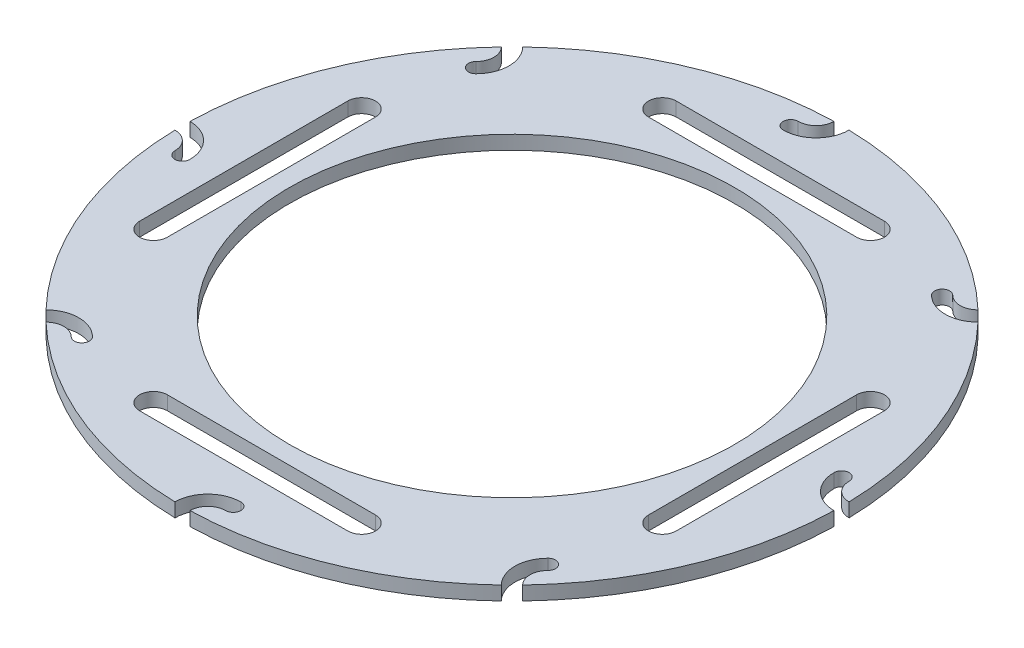
from build123d import *

# Parameters (mm, degrees)
SKETCH1_R           = 9.625
BOSS_EXTRUDE1_DEPTH = 0.6


with BuildPart() as part:
    # Sketch1 → Boss-Extrude1 (new body)
    with BuildSketch(Plane(origin=(0, 0, 0), x_dir=(1, 0, 0), z_dir=(0, 1, 0))):
        with BuildLine():
            ThreePointArc((13.474991136, 1.1), (13.700677051, 0.553298036), (14.246293378, 0.325))
            ThreePointArc((14.246293378, 0.325), (13.165283338, 5.453238911), (10.303460358, 9.84384095))
            ThreePointArc((10.303460358, 9.84384095), (9.29660086, 9.429085476), (8.290823601, 9.846458519))
            ThreePointArc((8.290823601, 9.846458519), (8.290823601, 10.306075068), (8.750440149, 10.306075068))
            ThreePointArc((8.750440149, 10.306075068), (9.296600856, 10.079082443), (9.84384095, 10.303460358))
            ThreePointArc((9.84384095, 10.303460358), (5.453238911, 13.165283338), (0.325, 14.246293378))
            ThreePointArc((0.325, 14.246293378), (-0.09368077, 13.24105979), (-1.1, 12.824995179))
            ThreePointArc((-1.1, 12.824995179), (-1.424997978, 13.149993158), (-1.1, 13.474991136))
            ThreePointArc((-1.1, 13.474991136), (-0.553298036, 13.700677051), (-0.325, 14.246293378))
            ThreePointArc((-0.325, 14.246293378), (-5.453238911, 13.165283338), (-9.84384095, 10.303460358))
            ThreePointArc((-9.84384095, 10.303460358), (-9.429085476, 9.29660086), (-9.846458519, 8.290823601))
            ThreePointArc((-9.846458519, 8.290823601), (-10.306075068, 8.290823601), (-10.306075068, 8.750440149))
            ThreePointArc((-10.306075068, 8.750440149), (-10.079082443, 9.296600856), (-10.303460358, 9.84384095))
            ThreePointArc((-10.303460358, 9.84384095), (-13.165283338, 5.453238911), (-14.246293378, 0.325))
            ThreePointArc((-14.246293378, 0.325), (-13.24105979, -0.09368077), (-12.824995179, -1.1))
            ThreePointArc((-12.824995179, -1.1), (-13.149993158, -1.424997978), (-13.474991136, -1.1))
            ThreePointArc((-13.474991136, -1.1), (-13.700677051, -0.553298036), (-14.246293378, -0.325))
            ThreePointArc((-14.246293378, -0.325), (-13.165283338, -5.453238911), (-10.303460358, -9.84384095))
            ThreePointArc((-10.303460358, -9.84384095), (-9.29660086, -9.429085476), (-8.290823601, -9.846458519))
            ThreePointArc((-8.290823601, -9.846458519), (-8.290823601, -10.306075068), (-8.750440149, -10.306075068))
            ThreePointArc((-8.750440149, -10.306075068), (-9.296600856, -10.079082443), (-9.84384095, -10.303460358))
            ThreePointArc((-9.84384095, -10.303460358), (-5.453238911, -13.165283338), (-0.325, -14.246293378))
            ThreePointArc((-0.325, -14.246293378), (0.09368077, -13.24105979), (1.1, -12.824995179))
            ThreePointArc((1.1, -12.824995179), (1.424997978, -13.149993158), (1.1, -13.474991136))
            ThreePointArc((1.1, -13.474991136), (0.553298036, -13.700677051), (0.325, -14.246293378))
            ThreePointArc((0.325, -14.246293378), (5.453238911, -13.165283338), (9.84384095, -10.303460358))
            ThreePointArc((9.84384095, -10.303460358), (9.429085476, -9.29660086), (9.846458519, -8.290823601))
            ThreePointArc((9.846458519, -8.290823601), (10.306075068, -8.290823601), (10.306075068, -8.750440149))
            ThreePointArc((10.306075068, -8.750440149), (10.079082443, -9.296600856), (10.303460358, -9.84384095))
            ThreePointArc((10.303460358, -9.84384095), (13.165283338, -5.453238911), (14.246293378, -0.325))
            ThreePointArc((14.246293378, -0.325), (13.24105979, 0.09368077), (12.824995179, 1.1))
            ThreePointArc((12.824995179, 1.1), (13.149993158, 1.424997978), (13.474991136, 1.1))
        make_face()
        with BuildLine():
            ThreePointArc((-4.5, -11.6), (-5.1, -11), (-4.5, -10.4))
            Line((-4.5, -10.4), (4.5, -10.4))
            ThreePointArc((4.5, -10.4), (5.1, -11), (4.5, -11.6))
            Line((4.5, -11.6), (-4.5, -11.6))
        make_face(mode=Mode.SUBTRACT)
        with BuildLine():
            ThreePointArc((-11.6, 4.5), (-11, 5.1), (-10.4, 4.5))
            Line((-10.4, 4.5), (-10.4, -4.5))
            ThreePointArc((-10.4, -4.5), (-11, -5.1), (-11.6, -4.5))
            Line((-11.6, -4.5), (-11.6, 4.5))
        make_face(mode=Mode.SUBTRACT)
        with Locations(Location((0, 0, 0), (0, 0, 270))):
            Circle(SKETCH1_R, mode=Mode.SUBTRACT)
        with BuildLine():
            ThreePointArc((11.6, -4.5), (11, -5.1), (10.4, -4.5))
            Line((10.4, -4.5), (10.4, 4.5))
            ThreePointArc((10.4, 4.5), (11, 5.1), (11.6, 4.5))
            Line((11.6, 4.5), (11.6, -4.5))
        make_face(mode=Mode.SUBTRACT)
        with BuildLine():
            ThreePointArc((4.5, 11.6), (5.1, 11), (4.5, 10.4))
            Line((4.5, 10.4), (-4.5, 10.4))
            ThreePointArc((-4.5, 10.4), (-5.1, 11), (-4.5, 11.6))
            Line((-4.5, 11.6), (4.5, 11.6))
        make_face(mode=Mode.SUBTRACT)
    extrude(amount=BOSS_EXTRUDE1_DEPTH)


solid = part.part
